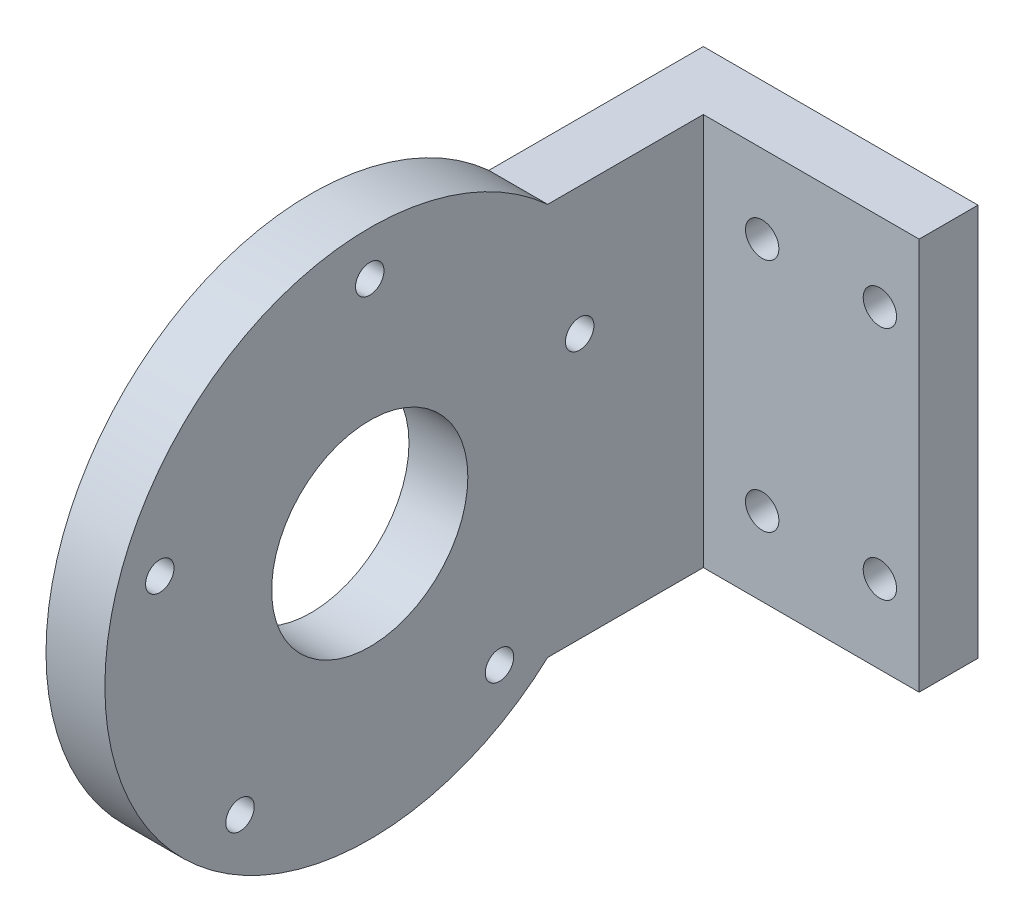
from build123d import *

# Parameters (mm, degrees)
SKETCH1_R           = 27
BOSS_EXTRUDE1_DEPTH = 6
SKETCH2_W           = 25
SKETCH2_H           = 40
BOSS_EXTRUDE2_DEPTH = 6
SKETCH3_R           = 10
SKETCH3_R_2         = 1.45
CUT_EXTRUDE1_DEPTH  = 6.01
SKETCH4_W           = 22.01
SKETCH4_H           = 40
SKETCH4_R           = 1.7
BOSS_EXTRUDE3_DEPTH = 6


with BuildPart() as part:
    # Sketch1 → Boss-Extrude1 (new body)
    with BuildSketch(Plane(origin=(221, 0, 0), x_dir=(0, 0, -1), z_dir=(1, 0, 0))):
        with Locations((-300, 300)):
            Circle(SKETCH1_R)
    extrude(amount=BOSS_EXTRUDE1_DEPTH)

    # Sketch2 → Boss-Extrude2 (add)
    with BuildSketch(Plane(origin=(221, 0, 0), x_dir=(0, 0, -1), z_dir=(1, 0, 0))):
        with Locations((-272.5, 300)):
            Rectangle(SKETCH2_W, SKETCH2_H)
    extrude(amount=BOSS_EXTRUDE2_DEPTH)

    # Sketch3 → Cut-Extrude1 (cut)
    with BuildSketch(Plane(origin=(221, 0, 0), x_dir=(0, 0, -1), z_dir=(1, 0, 0))):
        with Locations((-300, 300)):
            Circle(SKETCH3_R)
        with Locations((-300, 322.5)):
            Circle(SKETCH3_R_2)
        with Locations((-278.601228383, 306.952882373)):
            Circle(SKETCH3_R_2)
        with Locations((-286.774831823, 281.797117627)):
            Circle(SKETCH3_R_2)
        with Locations((-313.225168177, 281.797117627)):
            Circle(SKETCH3_R_2)
        with Locations((-321.398771617, 306.952882373)):
            Circle(SKETCH3_R_2)
    extrude(amount=CUT_EXTRUDE1_DEPTH, mode=Mode.SUBTRACT)

    # Sketch4 → Boss-Extrude3 (add)
    with BuildSketch(Plane.XY.offset(260)):
        with Locations((237.995, 300)):
            Rectangle(SKETCH4_W, SKETCH4_H)
        with Locations((233, 288)):
            Circle(SKETCH4_R, mode=Mode.SUBTRACT)
        with Locations((233, 312)):
            Circle(SKETCH4_R, mode=Mode.SUBTRACT)
        with Locations((245, 288)):
            Circle(SKETCH4_R, mode=Mode.SUBTRACT)
        with Locations((245, 312)):
            Circle(SKETCH4_R, mode=Mode.SUBTRACT)
    extrude(amount=BOSS_EXTRUDE3_DEPTH)


solid = part.part
